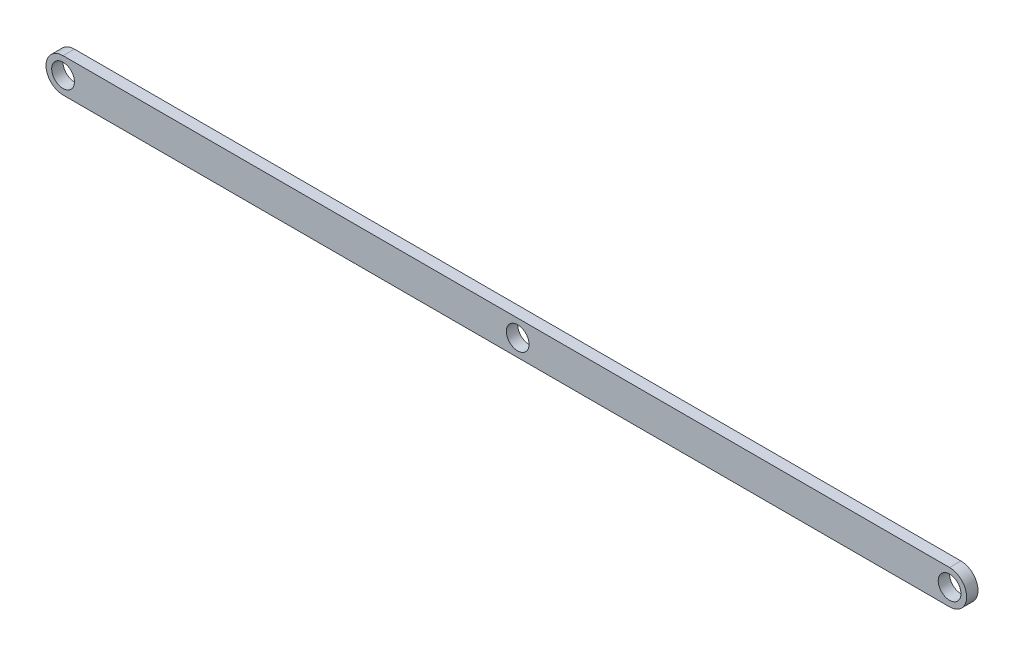
from build123d import *

# Parameters (mm, degrees)
SKETCH_1_R      = 10
EXTRUDE_2_DEPTH = 10


with BuildPart() as part:
    # Эскиз1 → Бобышка-Вытянуть2 (new body)
    with BuildSketch(Plane.XY):
        with BuildLine():
            Line((0, 15), (780, 15))
            ThreePointArc((780, 15), (795, 0), (780, -15))
            Line((780, -15), (0, -15))
            ThreePointArc((0, -15), (-15, 0), (0, 15))
        make_face()
        Circle(SKETCH_1_R, mode=Mode.SUBTRACT)
        with Locations((780, 0)):
            Circle(SKETCH_1_R, mode=Mode.SUBTRACT)
        with Locations((400, 0)):
            Circle(SKETCH_1_R, mode=Mode.SUBTRACT)
    extrude(amount=EXTRUDE_2_DEPTH)


solid = part.part
